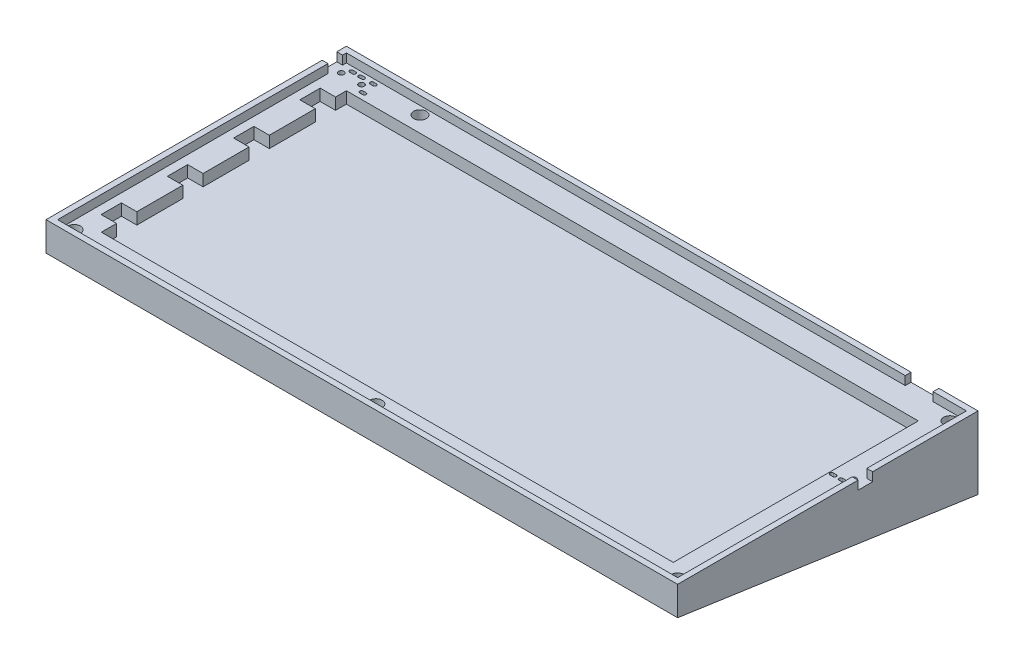
from build123d import *

# Parameters (mm, degrees)
SKETCH4_W           = 217.960426721
SKETCH4_H           = 103.66019812
SKETCH4_R           = 2.2
SKETCH4_R_2         = 0.95
BOSS_EXTRUDE1_DEPTH = 4
SKETCH4_7_W         = 217.960426721
SKETCH4_7_H         = 103.66019812
BOSS_EXTRUDE2_DEPTH = 3
CUT_EXTRUDE1_START  = -3
SKETCH4_8_R         = 2.2
CUT_EXTRUDE1_DEPTH  = 3
BOSS_EXTRUDE3_START = 4
BOSS_EXTRUDE3_DEPTH = 3
BOSS_EXTRUDE4_DEPTH = 217.960426721


with BuildPart() as part:
    # Sketch4 → Boss-Extrude1 (new body)
    with BuildSketch(Plane(origin=(0, 0, 0), x_dir=(1, 0, 0), z_dir=(0, 1, 0))):
        with Locations((106.680213361, 49.53009906)):
            Rectangle(SKETCH4_W, SKETCH4_H)
        with Locations(Location((2.54000508, 2.54000508, 0), (0, 0, 270))):
            Circle(SKETCH4_R, mode=Mode.SUBTRACT)
        with Locations(Location((106.68021336, 2.54000508, 0), (0, 0, 270))):
            Circle(SKETCH4_R, mode=Mode.SUBTRACT)
        Polygon((205.360426721, 91.06019812), (205.360426721, 6.5), (8, 6.5), (8, 11.741046482), (2.686004572, 11.741046482), (2.686004572, 18.741046482), (8, 18.741046482), (8, 34.601092202), (2.686004572, 34.601092202), (2.686004572, 41.601092202), (8, 41.601092202), (8, 57.461137922), (2.686004572, 57.461137922), (2.686004572, 64.461137922), (8, 64.461137922), (8, 80.321183642), (2.686004572, 80.321183642), (2.686004572, 87.321183642), (8, 87.321183642), (8, 91.06019812), align=None, mode=Mode.SUBTRACT)
        with Locations(Location((210.820421641, 2.54000508, 0), (0, 0, 270))):
            Circle(SKETCH4_R, mode=Mode.SUBTRACT)
        with Locations(Location((1.792989586, 95.504191008, 0), (0, 0, 270))):
            Circle(SKETCH4_R_2, mode=Mode.SUBTRACT)
        with BuildLine():
            ThreePointArc((11.003022606, 92.679171958), (10.403022606, 93.279171958), (11.003022606, 93.879171958))
            Line((11.003022606, 93.879171958), (11.992807214, 93.879171958))
            ThreePointArc((11.992807214, 93.879171958), (12.592808272, 93.279171958), (11.992807214, 92.679171958))
            Line((11.992807214, 92.679171958), (11.003022606, 92.679171958))
        make_face(mode=Mode.SUBTRACT)
        with Locations(Location((8.792989586, 95.504191008, 0), (0, 0, 270))):
            Circle(SKETCH4_R_2, mode=Mode.SUBTRACT)
        with BuildLine():
            ThreePointArc((2.993222758, 97.129182542), (2.393222758, 97.729182542), (2.993222758, 98.329182542))
            Line((2.993222758, 98.329182542), (3.992807214, 98.329182542))
            ThreePointArc((3.992807214, 98.329182542), (4.592807214, 97.729182542), (3.992807214, 97.129182542))
            Line((3.992807214, 97.129182542), (2.993222758, 97.129182542))
        make_face(mode=Mode.SUBTRACT)
        with BuildLine():
            ThreePointArc((6.093221234, 97.129182542), (5.493221234, 97.729182542), (6.093221234, 98.329182542))
            Line((6.093221234, 98.329182542), (7.09280569, 98.329182542))
            ThreePointArc((7.09280569, 98.329182542), (7.69280569, 97.729182542), (7.09280569, 97.129182542))
            Line((7.09280569, 97.129182542), (6.093221234, 97.129182542))
        make_face(mode=Mode.SUBTRACT)
        with BuildLine():
            ThreePointArc((10.093221234, 97.129182542), (9.493221234, 97.729182542), (10.093221234, 98.329182542))
            Line((10.093221234, 98.329182542), (11.09280569, 98.329182542))
            ThreePointArc((11.09280569, 98.329182542), (11.69280569, 97.729182542), (11.09280569, 97.129182542))
            Line((11.09280569, 97.129182542), (10.093221234, 97.129182542))
        make_face(mode=Mode.SUBTRACT)
        with Locations(Location((27.94005588, 96.52019304, 0), (0, 0, 270))):
            Circle(SKETCH4_R, mode=Mode.SUBTRACT)
        with BuildLine():
            ThreePointArc((206.267621031, 59.659133435), (205.667621031, 60.259133435), (206.267621031, 60.859133435))
            Line((206.267621031, 60.859133435), (207.267205486, 60.859133435))
            ThreePointArc((207.267205486, 60.859133435), (207.867205486, 60.259133435), (207.267205486, 59.659133435))
            Line((207.267205486, 59.659133435), (206.267621031, 59.659133435))
        make_face(mode=Mode.SUBTRACT)
        with BuildLine():
            ThreePointArc((209.367619507, 59.659133435), (208.767619507, 60.259133435), (209.367619507, 60.859133435))
            Line((209.367619507, 60.859133435), (210.367203962, 60.859133435))
            ThreePointArc((210.367203962, 60.859133435), (210.967203962, 60.259133435), (210.367203962, 59.659133435))
            Line((210.367203962, 59.659133435), (209.367619507, 59.659133435))
        make_face(mode=Mode.SUBTRACT)
        with Locations(Location((211.567437135, 62.484124968, 0), (0, 0, 270))):
            Circle(SKETCH4_R_2, mode=Mode.SUBTRACT)
        with Locations(Location((210.820421641, 96.52019304, 0), (0, 0, 270))):
            Circle(SKETCH4_R, mode=Mode.SUBTRACT)
    extrude(amount=BOSS_EXTRUDE1_DEPTH)

    # Sketch4<7> → Boss-Extrude2 (add)
    with BuildSketch(Plane(origin=(0, 0, 0), x_dir=(1, 0, 0), z_dir=(0, 1, 0))):
        with Locations((106.680213361, 49.53009906)):
            Rectangle(SKETCH4_7_W, SKETCH4_7_H)
    extrude(amount=-BOSS_EXTRUDE2_DEPTH)

    # Sketch4<8> → Cut-Extrude1 (cut)
    with BuildSketch(Plane(origin=(0, 0, 0), x_dir=(1, 0, 0), z_dir=(0, 1, 0)).offset(CUT_EXTRUDE1_START)):
        with Locations(Location((27.94005588, 96.52019304, 0), (0, 0, 270))):
            Circle(SKETCH4_8_R)
        with Locations(Location((210.820421641, 96.52019304, 0), (0, 0, 270))):
            Circle(SKETCH4_8_R)
        with Locations(Location((210.820421641, 2.54000508, 0), (0, 0, 270))):
            Circle(SKETCH4_8_R)
        with Locations(Location((106.68021336, 2.54000508, 0), (0, 0, 270))):
            Circle(SKETCH4_8_R)
        with Locations(Location((2.54000508, 2.54000508, 0), (0, 0, 270))):
            Circle(SKETCH4_8_R)
    extrude(amount=CUT_EXTRUDE1_DEPTH, mode=Mode.SUBTRACT)

    # Sketch4<10> → Boss-Extrude3 (add)
    with BuildSketch(Plane(origin=(0, 0, 0), x_dir=(1, 0, 0), z_dir=(0, 1, 0)).offset(BOSS_EXTRUDE3_START)):
        Polygon((-0.3, -0.3), (-0.3, 92.987071374), (-2.3, 92.987071374), (-2.3, -2.3), (215.660426721, -2.3), (215.660426721, 59.944119888), (213.660426721, 59.944119888), (213.660426721, -0.3), align=None)
        Polygon((-0.3, 99.36019812), (192.548387097, 99.36019812), (192.548387097, 101.36019812), (-2.3, 101.36019812), (-2.3, 98.044196088), (-0.3, 98.044196088), align=None)
        Polygon((202.168402337, 101.36019812), (202.168402337, 99.36019812), (213.660426721, 99.36019812), (213.660426721, 65.001244602), (215.660426721, 65.001244602), (215.660426721, 101.36019812), align=None)
    extrude(amount=BOSS_EXTRUDE3_DEPTH)

    # Sketch5 → Boss-Extrude4 (add)
    with BuildSketch(Plane.ZY.offset(2.3)):
        Polygon((2.3, -3), (-101.36019812, -3), (-101.36019812, -18), align=None)
    extrude(amount=-BOSS_EXTRUDE4_DEPTH)


solid = part.part
